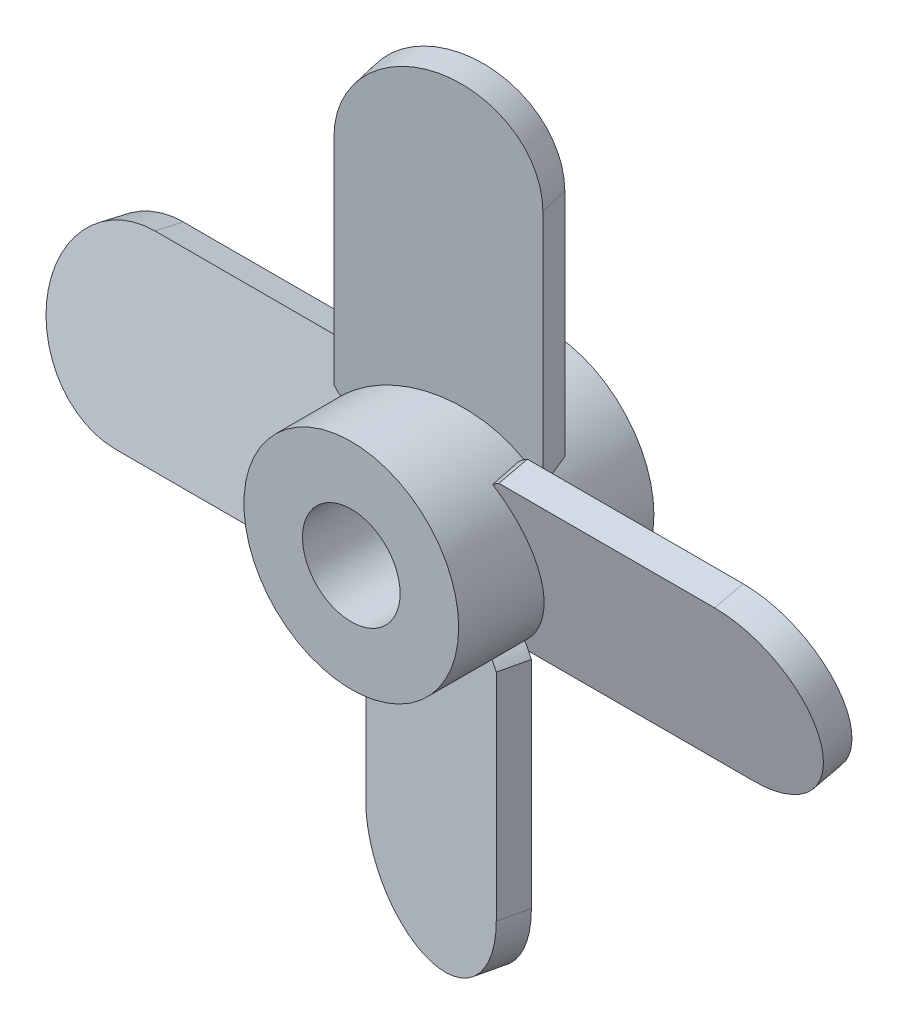
from build123d import *

# Parameters (mm, degrees)
SKETCH2_R           = 5.5
SKETCH2_R_2         = 2.5
BOSS_EXTRUDE1_DEPTH = 10
BOSS_EXTRUDE2_DEPTH = 0.75
CIRPATTERN1_COUNT   = 4


with BuildPart() as part:
    # Sketch2 → Boss-Extrude1 (new body)
    with BuildSketch(Plane.XY):
        Circle(SKETCH2_R)
        Circle(SKETCH2_R_2, mode=Mode.SUBTRACT)
    extrude(amount=BOSS_EXTRUDE1_DEPTH)

    # Sketch4 → Boss-Extrude2 (add, symmetric)
    with BuildSketch(Plane(origin=(0, -1.095927867, 4.746985116), x_dir=(0, 0.9743700647852367, 0.22495105434385892), z_dir=(0, 0.22495105434385892, -0.9743700647852367))):
        with BuildLine():
            Line((5.562035005, 4.289362297), (5.562035005, 15.338741246))
            ThreePointArc((5.562035005, 15.338741246), (1.102910343, 19.797865908), (-3.356214318, 15.338741246))
            Line((-3.356214318, 15.338741246), (-3.356214318, 3.072229714))
            ThreePointArc((-3.356214318, 3.072229714), (-1.450852963, 3.954597536), (0.520369242, 3.231231872))
            ThreePointArc((0.520369242, 3.231231872), (3.26034811, 2.716133916), (5.562035005, 4.289362297))
        make_face()
    boss_extrude2 = extrude(amount=BOSS_EXTRUDE2_DEPTH, both=True)

    # CirPattern1: Boss-Extrude2 ×4 about axis
    cirpattern1_axis = Axis((0, 0, 0), (0, 0, 1))
    for i in range(1, CIRPATTERN1_COUNT):
        add(boss_extrude2.rotate(cirpattern1_axis, i * 360 / CIRPATTERN1_COUNT))


solid = part.part
